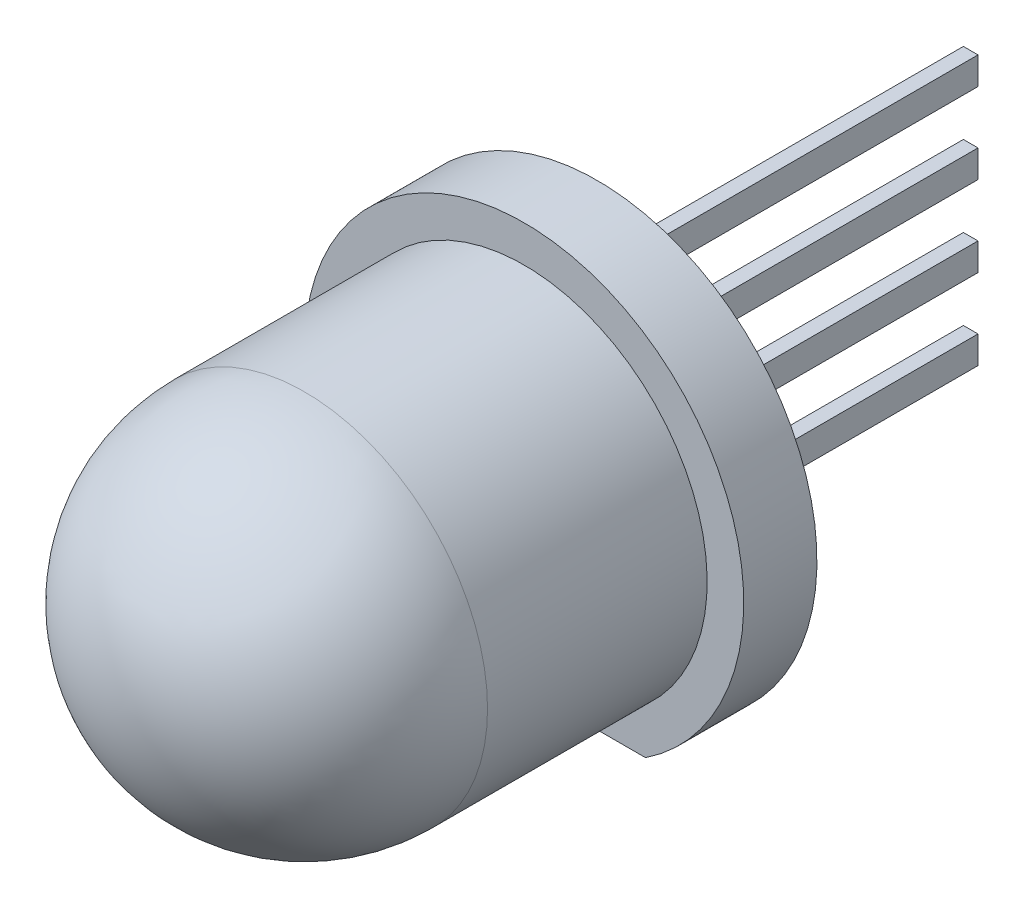
from build123d import *

# Parameters (mm, degrees)
SKETCH1_R             = 5
BOSS_EXTRUDE1_DEPTH   = 6
DOME1_FACE_RADIUS     = 5
DOME1_HEIGHT          = 5
SKETCH2_R             = 6
BOSS_EXTRUDE2_DEPTH   = 2
SKETCH3_W             = 16.856000324
SKETCH3_H             = 3.846233779
CUT_EXTRUDE4_DEPTH    = 2
SKETCH4_W             = 0.4
SKETCH4_H             = 0.75
BOSS_EXTRUDE3_DEPTH   = 10
BOSS_EXTRUDE3_2_DEPTH = 10
BOSS_EXTRUDE3_3_DEPTH = 10
BOSS_EXTRUDE3_4_DEPTH = 10


with BuildPart() as part:
    # Sketch1 → Boss-Extrude1 (new body)
    with BuildSketch(Plane.XY):
        Circle(SKETCH1_R)
    extrude(amount=BOSS_EXTRUDE1_DEPTH)

    # Dome1: a dome of height H over a round flat face of radius A is a cap of a sphere of radius (A * A + H * H) / (2 * H)
    dome1_r = (DOME1_FACE_RADIUS * DOME1_FACE_RADIUS + DOME1_HEIGHT * DOME1_HEIGHT) / (2 * DOME1_HEIGHT)
    dome1_base = Plane((0, 0, 6), z_dir=(0, 0, 1))
    with Locations(dome1_base.offset(DOME1_HEIGHT - dome1_r)):
        dome1_ball = Sphere(dome1_r, mode=Mode.PRIVATE)
    add(split(dome1_ball, bisect_by=dome1_base, keep=Keep.TOP, mode=Mode.PRIVATE))

    # Sketch2 → Boss-Extrude2 (add)
    with BuildSketch(Plane(origin=(0, 0, 0), x_dir=(-1, 0, 0), z_dir=(0, 0, -1))):
        Circle(SKETCH2_R)
    extrude(amount=BOSS_EXTRUDE2_DEPTH)

    # Sketch3 → Cut-Extrude4 (cut)
    with BuildSketch(Plane(origin=(0, 0, -2), x_dir=(-1, 0, 0), z_dir=(0, 0, -1))):
        with Locations((-0.159987828, -6.92311689)):
            Rectangle(SKETCH3_W, SKETCH3_H)
    extrude(amount=-CUT_EXTRUDE4_DEPTH, mode=Mode.SUBTRACT)


with BuildPart() as body_2:
    # Sketch4 → Boss-Extrude3 (new body)
    with BuildSketch(Plane(origin=(0, 0, -2), x_dir=(-1, 0, 0), z_dir=(0, 0, -1))):
        with Locations((-0.2, 1.594963341)):
            Rectangle(SKETCH4_W, SKETCH4_H)
    extrude(amount=BOSS_EXTRUDE3_DEPTH)


with BuildPart() as body_3:
    # Sketch4 → Boss-Extrude3 2 (new body)
    with BuildSketch(Plane(origin=(0, 0, -2), x_dir=(-1, 0, 0), z_dir=(0, 0, -1))):
        with Locations((-0.2, 3.795856983)):
            Rectangle(SKETCH4_W, SKETCH4_H)
    extrude(amount=BOSS_EXTRUDE3_2_DEPTH)


with BuildPart() as body_4:
    # Sketch4 → Boss-Extrude3 3 (new body)
    with BuildSketch(Plane(origin=(0, 0, -2), x_dir=(-1, 0, 0), z_dir=(0, 0, -1))):
        with Locations((-0.2, -0.605930301)):
            Rectangle(SKETCH4_W, SKETCH4_H)
    extrude(amount=BOSS_EXTRUDE3_3_DEPTH)


with BuildPart() as body_5:
    # Sketch4 → Boss-Extrude3 4 (new body)
    with BuildSketch(Plane(origin=(0, 0, -2), x_dir=(-1, 0, 0), z_dir=(0, 0, -1))):
        with Locations((-0.2, -2.806823942)):
            Rectangle(SKETCH4_W, SKETCH4_H)
    extrude(amount=BOSS_EXTRUDE3_4_DEPTH)


solid = Compound([part.part, body_2.part, body_3.part, body_4.part, body_5.part])
